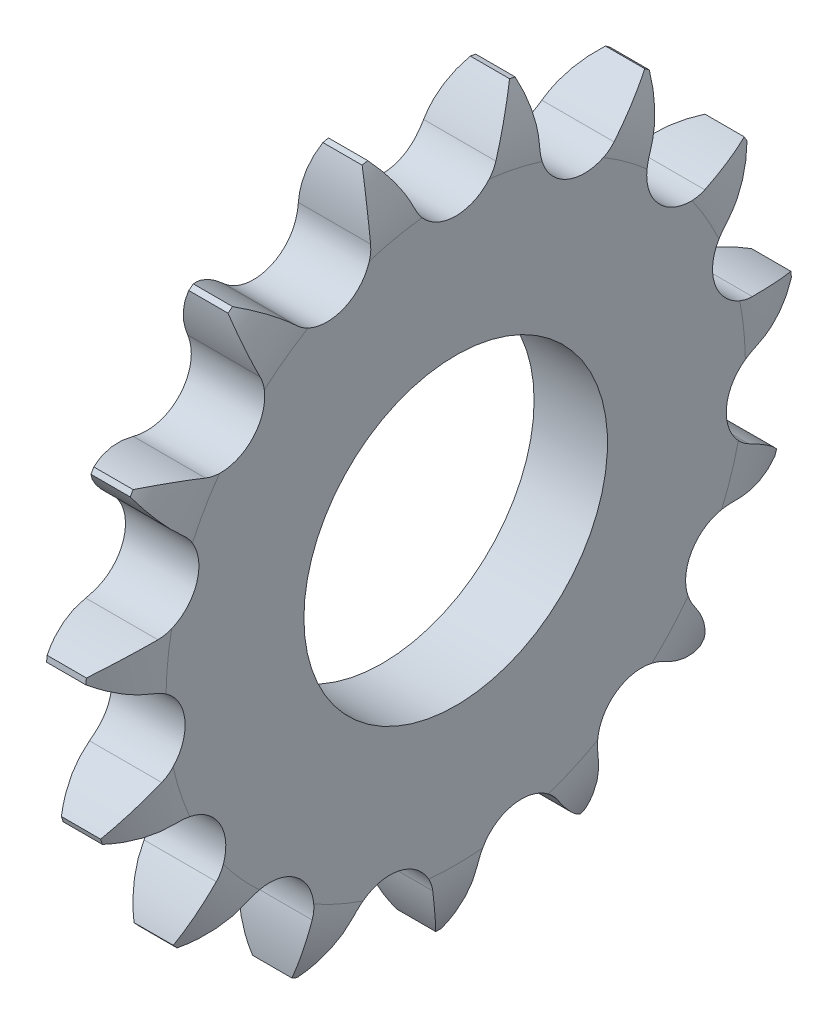
from build123d import *

# Parameters (mm, degrees)
TOOTHCUT_DEPTH  = 37.710811315
TEETHCUTS_COUNT = 15
TEETHCUTS_ANGLE = 336
BORSKE_R        = 11
BORE_DEPTH      = 50.0005


with BuildPart() as part:
    # BasProSke → Base-Revolve (revolve)
    with BuildSketch(Plane(origin=(0, 0, 0), x_dir=(1, 0, 0), z_dir=(0, 1, 0)), mode=Mode.PRIVATE) as base_revolve_sk:
        with BuildLine():
            Line((0, 0), (0, 20.988608354))
            ThreePointArc((0, 20.988608354), (0.314698702, 23.416771239), (1.238, 25.684484843))
            Line((1.238, 25.684484843), (4.0816, 25.684484843))
            ThreePointArc((4.0816, 25.684484843), (5.004901298, 23.416771239), (5.3196, 20.988608354))
            Line((5.3196, 20.988608354), (5.3196, 0))
            Line((5.3196, 0), (0, 0))
        make_face()
    revolve(base_revolve_sk.sketch.rotate(Axis((-10, 0, 0), (1, 0, 0)), 180), axis=Axis((-10, 0, 0), (1, 0, 0)))

    # TooCutSke → ToothCut (cut, through all)
    with BuildSketch(Plane(origin=(0, 0, 0), x_dir=(0, 0, -1), z_dir=(1, 0, 0))):
        with BuildLine():
            ThreePointArc((2.951828939, 21.685132796), (4.063020217, 23.756940993), (5.530366998, 25.593793922))
            ThreePointArc((5.530366998, 25.593793922), (0, 26.184484843), (-5.530366998, 25.593793922))
            ThreePointArc((-5.530366998, 25.593793922), (-4.063020217, 23.756940993), (-2.951828939, 21.685132796))
            ThreePointArc((-2.951828939, 21.685132796), (0, 19.731359843), (2.951828939, 21.685132796))
        make_face()
    toothcut = extrude(amount=TOOTHCUT_DEPTH, mode=Mode.SUBTRACT)

    # TeethCuts: ToothCut ×15 about axis
    teethcuts_axis = Axis((-10, 0, 0), (1, 0, 0))
    for i in range(1, TEETHCUTS_COUNT):
        add(toothcut.rotate(teethcuts_axis, i * TEETHCUTS_ANGLE / (TEETHCUTS_COUNT - 1)), mode=Mode.SUBTRACT)

    # BorSke → Bore (cut, symmetric)
    with BuildSketch(Plane(origin=(0, 0, 0), x_dir=(0, 0, -1), z_dir=(1, 0, 0))):
        with Locations(Location((0, 0, 0), (0, 0, 180))):
            Circle(BORSKE_R)
    extrude(amount=BORE_DEPTH, both=True, mode=Mode.SUBTRACT)


solid = part.part
